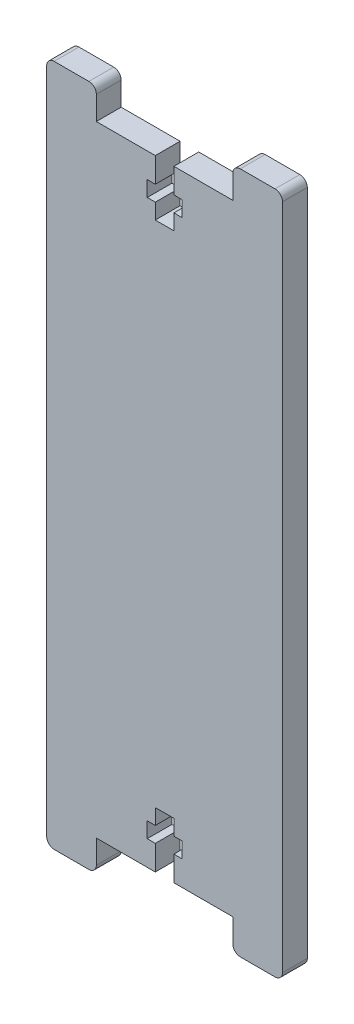
from build123d import *

# Parameters (mm, degrees)
EXTRUDE_1_DEPTH = 4
FILLET_1_R      = 1.2


with BuildPart() as part:
    # 草图1 → 凸台-拉伸1 (new body)
    with BuildSketch(Plane.XY):
        Polygon((14.909090909, 14), (14.909090909, -96), (6.909090909, -96), (6.909090909, -91), (-2.590909091, -91), (-2.590909091, -87), (-1.290909091, -87), (-1.290909091, -84.5), (-2.590909091, -84.5), (-2.590909091, -82), (-5.590909091, -82), (-5.590909091, -84.5), (-6.890909091, -84.5), (-6.890909091, -87), (-5.590909091, -87), (-5.590909091, -91), (-15.090909091, -91), (-15.090909091, -96), (-23.090909091, -96), (-23.090909091, 14), (-15.090909091, 14), (-15.090909091, 9), (-5.590909091, 9), (-5.590909091, 5), (-6.890909091, 5), (-6.890909091, 2.5), (-5.590909091, 2.5), (-5.590909091, 0), (-2.590909091, 0), (-2.590909091, 2.5), (-1.290909091, 2.5), (-1.290909091, 5), (-2.590909091, 5), (-2.590909091, 9), (6.909090909, 9), (6.909090909, 14), align=None)
    extrude(amount=EXTRUDE_1_DEPTH)

    # 圆角1
    fillet_1_edges = [part.edges().sort_by_distance(p)[0] for p in [
        (6.909090909, 14, 2),
        (14.909090909, 14, 2),
        (14.909090909, -96, 2),
        (6.909090909, -96, 2),
        (-15.090909091, -96, 2),
        (-23.090909091, -96, 2),
        (-23.090909091, 14, 2),
        (-15.090909091, 14, 2),
    ]]
    fillet(fillet_1_edges, radius=FILLET_1_R)


solid = part.part
